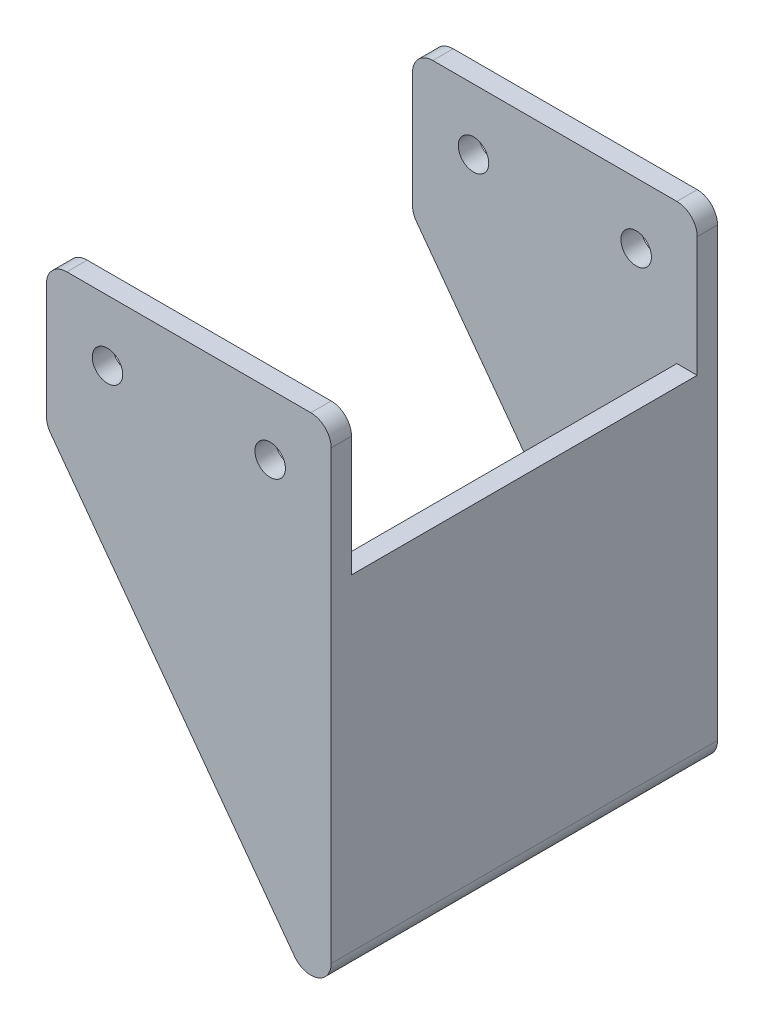
from build123d import *

# Parameters (mm, degrees)
SKETCH1_R           = 0.75
BOSS_EXTRUDE1_DEPTH = 9.5
CUT_EXTRUDE1_DEPTH  = 8.5


with BuildPart() as part:
    # Sketch1 → Boss-Extrude1 (new, symmetric)
    with BuildSketch(Plane.XY):
        with BuildLine():
            Line((0, -1), (0, -22.957082326))
            ThreePointArc((0, -22.957082326), (-0.687794809, -23.907097019), (-1.805055837, -23.550281364))
            Line((-1.805055837, -23.550281364), (-13.805055837, -7.264567078))
            ThreePointArc((-13.805055837, -7.264567078), (-13.950014694, -6.983573231), (-14, -6.67136804))
            Line((-14, -6.67136804), (-14, -1))
            ThreePointArc((-14, -1), (-13.707106781, -0.292893219), (-13, 0))
            Line((-13, 0), (-1, 0))
            ThreePointArc((-1, 0), (-0.292893219, -0.292893219), (0, -1))
        make_face()
        with Locations((-11, -3)):
            Circle(SKETCH1_R, mode=Mode.SUBTRACT)
        with Locations((-3, -3)):
            Circle(SKETCH1_R, mode=Mode.SUBTRACT)
    extrude(amount=BOSS_EXTRUDE1_DEPTH, both=True)

    # Sketch2 → Cut-Extrude1 (cut, symmetric)
    with BuildSketch(Plane.XY):
        Polygon((-1, -28.348579048), (-1, -6.907097019), (7.926418822, -6.907097019), (7.294916487, 4.746991522), (-21.667349138, 6.871135739), (-20.03469418, -23.258769395), align=None)
    extrude(amount=CUT_EXTRUDE1_DEPTH, both=True, mode=Mode.SUBTRACT)


solid = part.part
